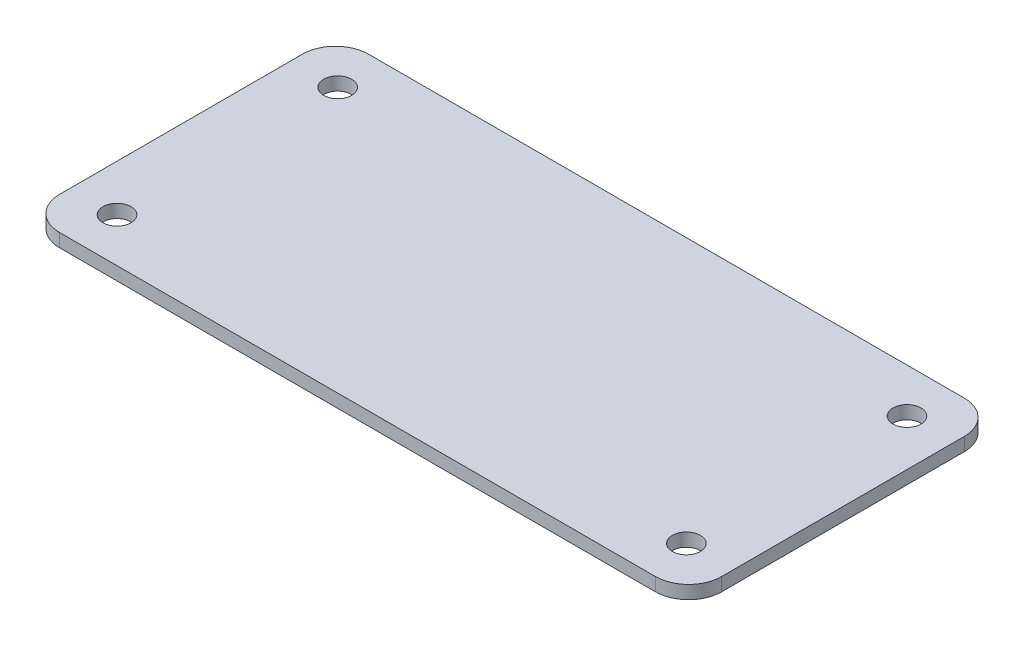
from build123d import *

# Parameters (mm, degrees)
ESBO_O2_W                = 150
ESBO_O2_H                = 70
RESSALTO_EXTRUS_O1_DEPTH = 3
ESBO_O4_R                = 3.175
CORTE_EXTRUS_O1_DEPTH    = 3
FILETE1_R                = 7.5


with BuildPart() as part:
    # Esboço2 → Ressalto-extrusão1 (new body)
    with BuildSketch(Plane(origin=(0, 0, 0), x_dir=(1, 0, 0), z_dir=(0, 1, 0))):
        with Locations((75, 35)):
            Rectangle(ESBO_O2_W, ESBO_O2_H)
    extrude(amount=RESSALTO_EXTRUS_O1_DEPTH)

    # Esboço4 → Corte-extrusão1 (cut)
    with BuildSketch(Plane(origin=(0, 3, 0), x_dir=(1, 0, 0), z_dir=(0, 1, 0))):
        with Locations(Location((10.5, 60, 0), (0, 0, 270))):
            Circle(ESBO_O4_R)
        with Locations(Location((139.5, 60, 0), (0, 0, 270))):
            Circle(ESBO_O4_R)
        with Locations(Location((139.5, 10, 0), (0, 0, 270))):
            Circle(ESBO_O4_R)
        with Locations(Location((10.5, 10, 0), (0, 0, 270))):
            Circle(ESBO_O4_R)
    extrude(amount=-CORTE_EXTRUS_O1_DEPTH, mode=Mode.SUBTRACT)

    # Filete1
    filete1_edges = [part.edges().sort_by_distance(p)[0] for p in [
        (0, 1.5, -70),
        (150, 1.5, -70),
        (150, 1.5, 0),
        (0, 1.5, 0),
    ]]
    fillet(filete1_edges, radius=FILETE1_R)


solid = part.part
